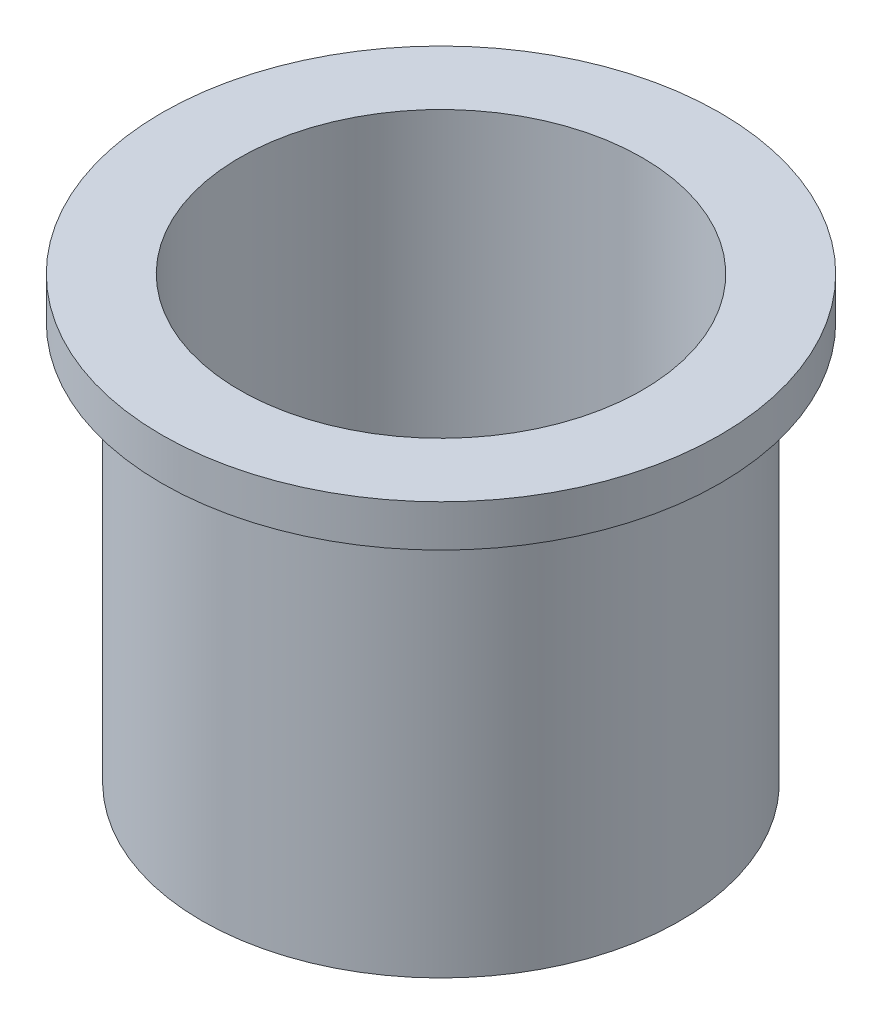
from build123d import *

# Parameters (mm, degrees)
GUIDE_BUSH_BARREL_SKETCH_R = 6
GUIDE_BUSH_BARREL_DEPTH    = 10
GUIDE_BUSH_FLANGE_SKETCH_R = 7
GUIDE_BUSH_FLANGE_DEPTH    = 1.05
RUNNING_BORE_SKETCH_R      = 5.05
RUNNING_BORE_DEPTH         = 11.25


with BuildPart() as part:
    # Guide bush barrel sketch → Guide bush barrel (new body)
    with BuildSketch(Plane(origin=(0, -105.98, 0), x_dir=(1, 0, 0), z_dir=(0, 1, 0))):
        with Locations(Location((-20.291651246, 0, 0), (0, 0, 270))):
            Circle(GUIDE_BUSH_BARREL_SKETCH_R)
    extrude(amount=GUIDE_BUSH_BARREL_DEPTH)

    # Guide bush flange sketch → Guide bush flange (add)
    with BuildSketch(Plane(origin=(0, -95.98, 0), x_dir=(1, 0, 0), z_dir=(0, 1, 0))):
        with Locations(Location((-20.291651246, 0, 0), (0, 0, 270))):
            Circle(GUIDE_BUSH_FLANGE_SKETCH_R)
    extrude(amount=GUIDE_BUSH_FLANGE_DEPTH)

    # Running bore sketch → Running bore (cut)
    with BuildSketch(Plane(origin=(0, -106.08, 0), x_dir=(1, 0, 0), z_dir=(0, 1, 0))):
        with Locations(Location((-20.291651246, 0, 0), (0, 0, 90))):
            Circle(RUNNING_BORE_SKETCH_R)
    extrude(amount=RUNNING_BORE_DEPTH, mode=Mode.SUBTRACT)


solid = part.part
